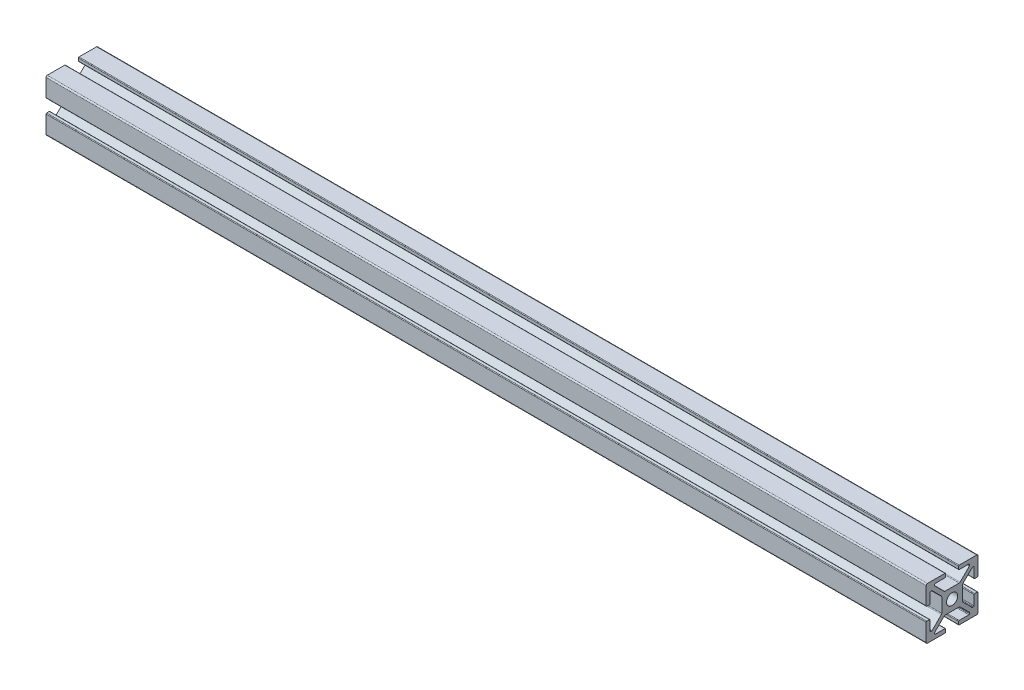
from build123d import *

# Parameters (mm, degrees)
SKETCH_1_R      = 2.15
EXTRUDE_1_DEPTH = 340


with BuildPart() as part:
    # Эскиз1 → Бобышка-Вытянуть1 (new body)
    with BuildSketch(Plane(origin=(0, 0, 170), x_dir=(0, 0, 1), z_dir=(-1, 0, 0))):
        with BuildLine():
            Line((-10, -2.75), (-10, -9.5))
            ThreePointArc((-10, -9.5), (-9.853553391, -9.853553391), (-9.5, -10))
            Line((-9.5, -10), (-2.75, -10))
            ThreePointArc((-2.75, -10), (-2.573223305, -9.926776695), (-2.5, -9.75))
            Line((-2.5, -9.75), (-2.5, -8.75))
            ThreePointArc((-2.5, -8.75), (-2.573223305, -8.573223305), (-2.75, -8.5))
            Line((-2.75, -8.5), (-6.5, -8.5))
            ThreePointArc((-6.5, -8.5), (-6.676776695, -8.426776695), (-6.75, -8.25))
            Line((-6.75, -8.25), (-6.75, -7.914213562))
            ThreePointArc((-6.75, -7.914213562), (-6.730969883, -7.818542704), (-6.676776695, -7.737436867))
            Line((-6.676776695, -7.737436867), (-3.085786438, -4.146446609))
            ThreePointArc((-3.085786438, -4.146446609), (-2.923574763, -4.038060234), (-2.732233047, -4))
            Line((-2.732233047, -4), (2.732233047, -4))
            ThreePointArc((2.732233047, -4), (2.923574763, -4.038060234), (3.085786438, -4.146446609))
            Line((3.085786438, -4.146446609), (6.676776695, -7.737436867))
            ThreePointArc((6.676776695, -7.737436867), (6.730969883, -7.818542704), (6.75, -7.914213562))
            Line((6.75, -7.914213562), (6.75, -8.25))
            ThreePointArc((6.75, -8.25), (6.676776695, -8.426776695), (6.5, -8.5))
            Line((6.5, -8.5), (2.75, -8.5))
            ThreePointArc((2.75, -8.5), (2.573223305, -8.573223305), (2.5, -8.75))
            Line((2.5, -8.75), (2.5, -9.75))
            ThreePointArc((2.5, -9.75), (2.573223305, -9.926776695), (2.75, -10))
            Line((2.75, -10), (9.5, -10))
            ThreePointArc((9.5, -10), (9.853553391, -9.853553391), (10, -9.5))
            Line((10, -9.5), (10, -2.75))
            ThreePointArc((10, -2.75), (9.926776695, -2.573223305), (9.75, -2.5))
            Line((9.75, -2.5), (8.75, -2.5))
            ThreePointArc((8.75, -2.5), (8.573223305, -2.573223305), (8.5, -2.75))
            Line((8.5, -2.75), (8.5, -6.5))
            ThreePointArc((8.5, -6.5), (8.426776695, -6.676776695), (8.25, -6.75))
            Line((8.25, -6.75), (7.914213562, -6.75))
            ThreePointArc((7.914213562, -6.75), (7.818542704, -6.730969883), (7.737436867, -6.676776695))
            Line((7.737436867, -6.676776695), (4.146446609, -3.085786438))
            ThreePointArc((4.146446609, -3.085786438), (4.038060234, -2.923574763), (4, -2.732233047))
            Line((4, -2.732233047), (4, 2.732233047))
            ThreePointArc((4, 2.732233047), (4.038060234, 2.923574763), (4.146446609, 3.085786438))
            Line((4.146446609, 3.085786438), (7.737436867, 6.676776695))
            ThreePointArc((7.737436867, 6.676776695), (7.818542704, 6.730969883), (7.914213562, 6.75))
            Line((7.914213562, 6.75), (8.25, 6.75))
            ThreePointArc((8.25, 6.75), (8.426776695, 6.676776695), (8.5, 6.5))
            Line((8.5, 6.5), (8.5, 2.75))
            ThreePointArc((8.5, 2.75), (8.573223305, 2.573223305), (8.75, 2.5))
            Line((8.75, 2.5), (9.75, 2.5))
            ThreePointArc((9.75, 2.5), (9.926776695, 2.573223305), (10, 2.75))
            Line((10, 2.75), (10, 9.5))
            ThreePointArc((10, 9.5), (9.853553391, 9.853553391), (9.5, 10))
            Line((9.5, 10), (2.75, 10))
            ThreePointArc((2.75, 10), (2.573223305, 9.926776695), (2.5, 9.75))
            Line((2.5, 9.75), (2.5, 8.75))
            ThreePointArc((2.5, 8.75), (2.573223305, 8.573223305), (2.75, 8.5))
            Line((2.75, 8.5), (6.5, 8.5))
            ThreePointArc((6.5, 8.5), (6.676776695, 8.426776695), (6.75, 8.25))
            Line((6.75, 8.25), (6.75, 7.810660172))
            Line((6.75, 7.810660172), (3.012563133, 4.073223305))
            ThreePointArc((3.012563133, 4.073223305), (2.931457296, 4.019030117), (2.835786438, 4))
            Line((2.835786438, 4), (-2.732233047, 4))
            ThreePointArc((-2.732233047, 4), (-2.923574763, 4.038060234), (-3.085786438, 4.146446609))
            Line((-3.085786438, 4.146446609), (-6.676776695, 7.737436867))
            ThreePointArc((-6.676776695, 7.737436867), (-6.730969883, 7.818542704), (-6.75, 7.914213562))
            Line((-6.75, 7.914213562), (-6.75, 8.25))
            ThreePointArc((-6.75, 8.25), (-6.676776695, 8.426776695), (-6.5, 8.5))
            Line((-6.5, 8.5), (-2.75, 8.5))
            ThreePointArc((-2.75, 8.5), (-2.573223305, 8.573223305), (-2.5, 8.75))
            Line((-2.5, 8.75), (-2.5, 9.75))
            ThreePointArc((-2.5, 9.75), (-2.573223305, 9.926776695), (-2.75, 10))
            Line((-2.75, 10), (-9.5, 10))
            ThreePointArc((-9.5, 10), (-9.853553391, 9.853553391), (-10, 9.5))
            Line((-10, 9.5), (-10, 2.75))
            ThreePointArc((-10, 2.75), (-9.926776695, 2.573223305), (-9.75, 2.5))
            Line((-9.75, 2.5), (-8.75, 2.5))
            ThreePointArc((-8.75, 2.5), (-8.573223305, 2.573223305), (-8.5, 2.75))
            Line((-8.5, 2.75), (-8.5, 6.5))
            ThreePointArc((-8.5, 6.5), (-8.426776695, 6.676776695), (-8.25, 6.75))
            Line((-8.25, 6.75), (-7.914213562, 6.75))
            ThreePointArc((-7.914213562, 6.75), (-7.818542704, 6.730969883), (-7.737436867, 6.676776695))
            Line((-7.737436867, 6.676776695), (-4.146446609, 3.085786438))
            ThreePointArc((-4.146446609, 3.085786438), (-4.038060234, 2.923574763), (-4, 2.732233047))
            Line((-4, 2.732233047), (-4, -2.732233047))
            ThreePointArc((-4, -2.732233047), (-4.038060234, -2.923574763), (-4.146446609, -3.085786438))
            Line((-4.146446609, -3.085786438), (-7.737436867, -6.676776695))
            ThreePointArc((-7.737436867, -6.676776695), (-7.818542704, -6.730969883), (-7.914213562, -6.75))
            Line((-7.914213562, -6.75), (-8.25, -6.75))
            ThreePointArc((-8.25, -6.75), (-8.426776695, -6.676776695), (-8.5, -6.5))
            Line((-8.5, -6.5), (-8.5, -2.75))
            ThreePointArc((-8.5, -2.75), (-8.573223305, -2.573223305), (-8.75, -2.5))
            Line((-8.75, -2.5), (-9.75, -2.5))
            ThreePointArc((-9.75, -2.5), (-9.926776695, -2.573223305), (-10, -2.75))
        make_face()
        with Locations(Location((0, 0, 0), (0, 0, 180))):
            Circle(SKETCH_1_R, mode=Mode.SUBTRACT)
    extrude(amount=-EXTRUDE_1_DEPTH)


solid = part.part
